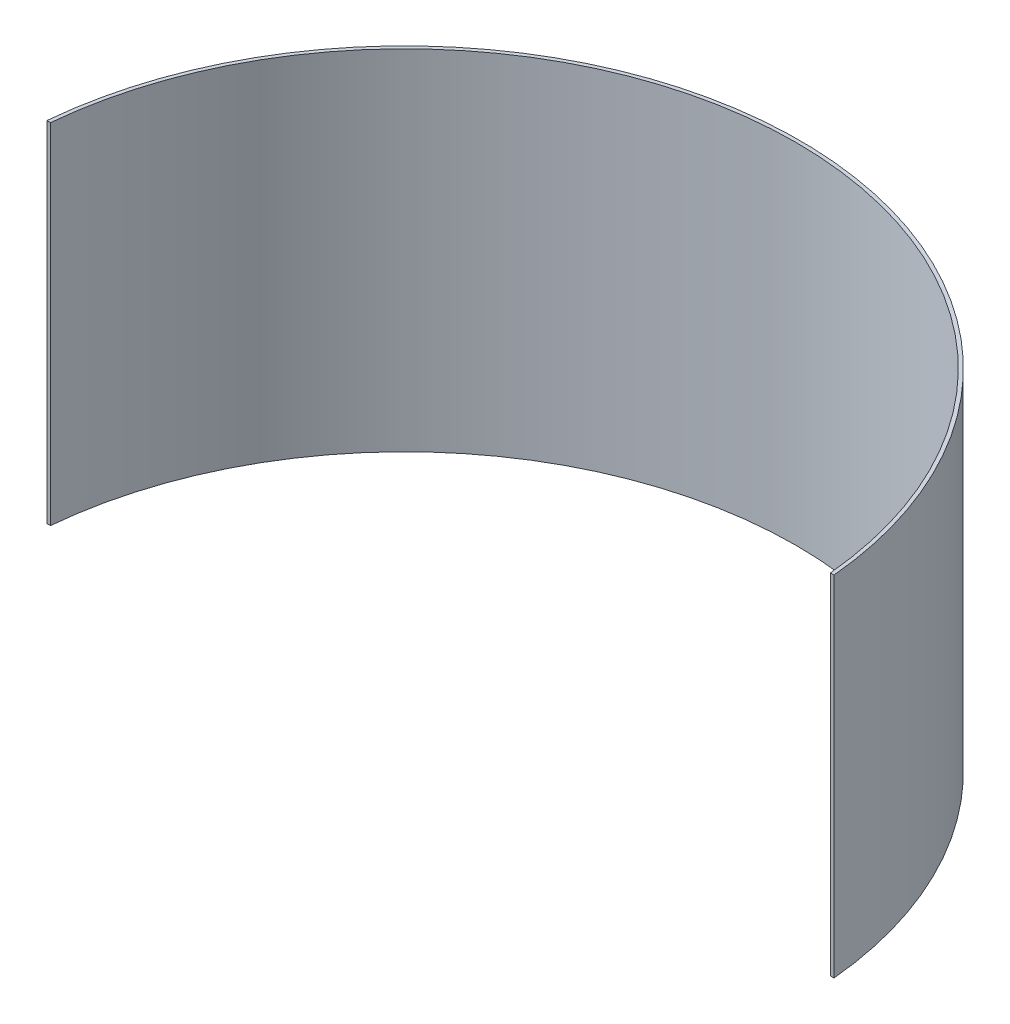
from build123d import *

# Parameters (mm, degrees)
BOSS_EXTRUDE1_DEPTH = 971.31


with BuildPart() as part:
    # Sketch1 → Boss-Extrude1 (new body)
    with BuildSketch(Plane(origin=(0, 0, 0), x_dir=(1, 0, 0), z_dir=(0, 1, 0))):
        with BuildLine():
            Line((0, 0), (10.041965167, 0))
            ThreePointArc((10.041965167, 0), (1095.445, 989.998740133), (2180.848034833, 0))
            Line((2180.848034833, 0), (2190.89, 0))
            ThreePointArc((2190.89, 0), (1095.445, 999.998740133), (0, 0))
        make_face()
    extrude(amount=BOSS_EXTRUDE1_DEPTH)


solid = part.part
